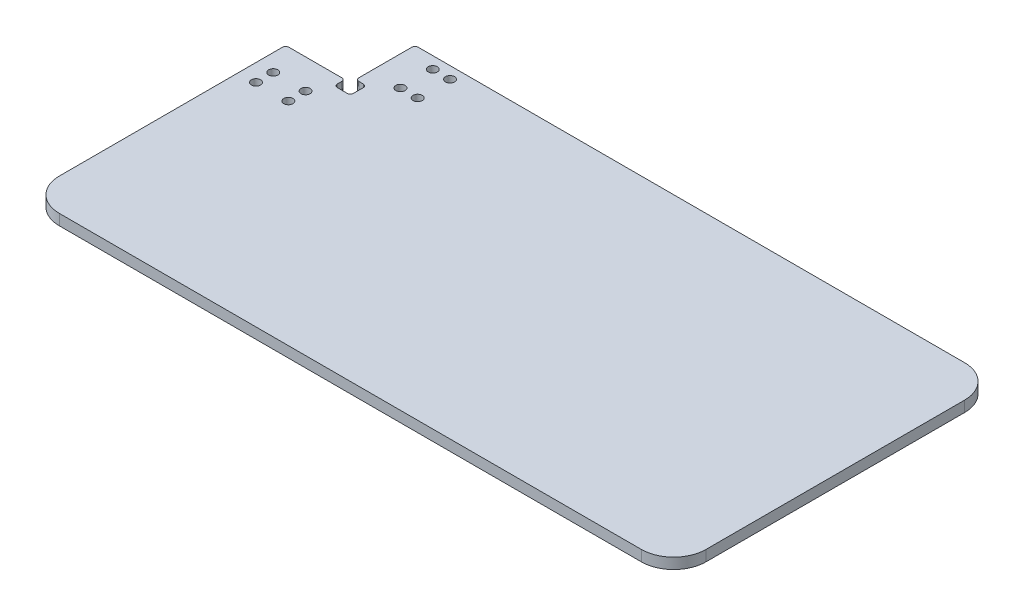
from build123d import *

# Parameters (mm, degrees)
SKETCH_1_R      = 4.25
EXTRUDE_1_DEPTH = 10
FILLET_1_R      = 30
FILLET_2_R      = 3


with BuildPart() as part:
    # 草图1 → 凸台-拉伸1 (new body)
    with BuildSketch(Plane(origin=(0, 0, 0), x_dir=(1, 0, 0), z_dir=(0, 1, 0))):
        Polygon((60, 0), (60, -55), (70, -55), (70, -70), (55, -70), (55, -60), (0, -60), (0, -300), (600, -300), (600, 0), align=None)
        with Locations(Location((103.5, -11, 0), (0, 0, 270))):
            Circle(SKETCH_1_R, mode=Mode.SUBTRACT)
        with Locations(Location((87.5, -11, 0), (0, 0, 270))):
            Circle(SKETCH_1_R, mode=Mode.SUBTRACT)
        with Locations(Location((103.5, -41, 0), (0, 0, 270))):
            Circle(SKETCH_1_R, mode=Mode.SUBTRACT)
        with Locations(Location((87.5, -41, 0), (0, 0, 270))):
            Circle(SKETCH_1_R, mode=Mode.SUBTRACT)
        with Locations(Location((16, -87.5, 0), (0, 0, 270))):
            Circle(SKETCH_1_R, mode=Mode.SUBTRACT)
        with Locations(Location((46, -87.5, 0), (0, 0, 270))):
            Circle(SKETCH_1_R, mode=Mode.SUBTRACT)
        with Locations(Location((16, -103.5, 0), (0, 0, 270))):
            Circle(SKETCH_1_R, mode=Mode.SUBTRACT)
        with Locations(Location((46, -103.5, 0), (0, 0, 270))):
            Circle(SKETCH_1_R, mode=Mode.SUBTRACT)
    extrude(amount=EXTRUDE_1_DEPTH)

    # 圆角1
    fillet_1_edges = [part.edges().sort_by_distance(p)[0] for p in [
        (600, 5, 300),
        (0, 5, 300),
        (600, 5, 0),
    ]]
    fillet(fillet_1_edges, radius=FILLET_1_R)

    # 圆角2
    fillet_2_edges = [part.edges().sort_by_distance(p)[0] for p in [
        (0, 5, 60),
        (55, 5, 60),
        (55, 5, 70),
        (70, 5, 70),
        (70, 5, 55),
        (60, 5, 55),
        (60, 5, 0),
    ]]
    fillet(fillet_2_edges, radius=FILLET_2_R)


solid = part.part
